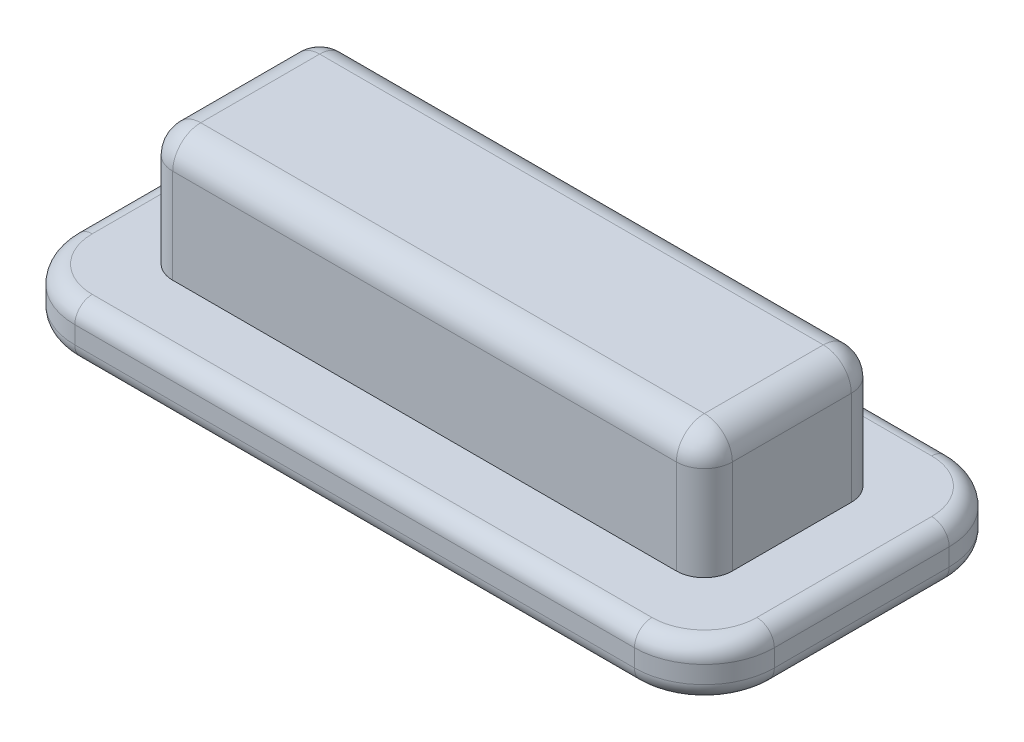
from build123d import *

# Parameters (mm, degrees)
SKETCH1_W           = 8
SKETCH1_H           = 2.5
BOSS_EXTRUDE1_DEPTH = 1.75
SKETCH2_W           = 10
SKETCH2_H           = 4.5
BOSS_EXTRUDE2_DEPTH = 0.75
FILLET1_R           = 0.4
FILLET2_R           = 0.4
FILLET3_R           = 1
FILLET4_R           = 0.25


with BuildPart() as part:
    # Sketch1 → Boss-Extrude1 (new body)
    with BuildSketch(Plane(origin=(0, 0, 0), x_dir=(1, 0, 0), z_dir=(0, 1, 0))):
        with Locations((4, 1.25)):
            Rectangle(SKETCH1_W, SKETCH1_H)
    extrude(amount=BOSS_EXTRUDE1_DEPTH)

    # Sketch2 → Boss-Extrude2 (add)
    with BuildSketch(Plane.XZ):
        with Locations((4, -1.25)):
            Rectangle(SKETCH2_W, SKETCH2_H)
    extrude(amount=BOSS_EXTRUDE2_DEPTH)

    # Fillet1
    fillet1_edges = [part.edges().sort_by_distance(p)[0] for p in [
        (0, 0.875, -2.5),
        (0, 0.875, 0),
        (8, 0.875, 0),
        (8, 0.875, -2.5),
    ]]
    fillet(fillet1_edges, radius=FILLET1_R)

    # Fillet2
    fillet2_edges = [part.edges().sort_by_distance(p)[0] for p in [
        (8, 1.75, -1.25),
        (4, 1.75, 0),
        (4, 1.75, -2.5),
        (0, 1.75, -1.25),
        (0.117157288, 1.75, -0.117157288),
        (0.117157288, 1.75, -2.382842712),
        (7.882842712, 1.75, -2.382842712),
        (7.882842712, 1.75, -0.117157288),
    ]]
    fillet(fillet2_edges, radius=FILLET2_R)

    # Fillet3
    fillet3_edges = [part.edges().sort_by_distance(p)[0] for p in [
        (-1, -0.375, 1),
        (-1, -0.375, -3.5),
        (9, -0.375, -3.5),
        (9, -0.375, 1),
    ]]
    fillet(fillet3_edges, radius=FILLET3_R)

    # Fillet4
    fillet4_edges = [part.edges().sort_by_distance(p)[0] for p in [
        (9, 0, -1.25),
        (9, -0.75, -1.25),
        (-1, 0, -1.25),
        (4, 0, 1),
        (4, 0, -3.5),
        (8.707106781, 0, 0.707106781),
        (-0.7071067811865478, 0, 0.7071067811865477),
        (-0.707106781, 0, -3.207106781),
        (8.707106781, 0, -3.207106781),
        (4, -0.75, -3.5),
        (-1, -0.75, -1.25),
        (4, -0.75, 1),
        (8.707106781, -0.75, 0.707106781),
        (-0.707106781, -0.75, 0.707106781),
        (-0.707106781, -0.75, -3.207106781),
        (8.707106781, -0.75, -3.207106781),
    ]]
    fillet(fillet4_edges, radius=FILLET4_R)


solid = part.part
